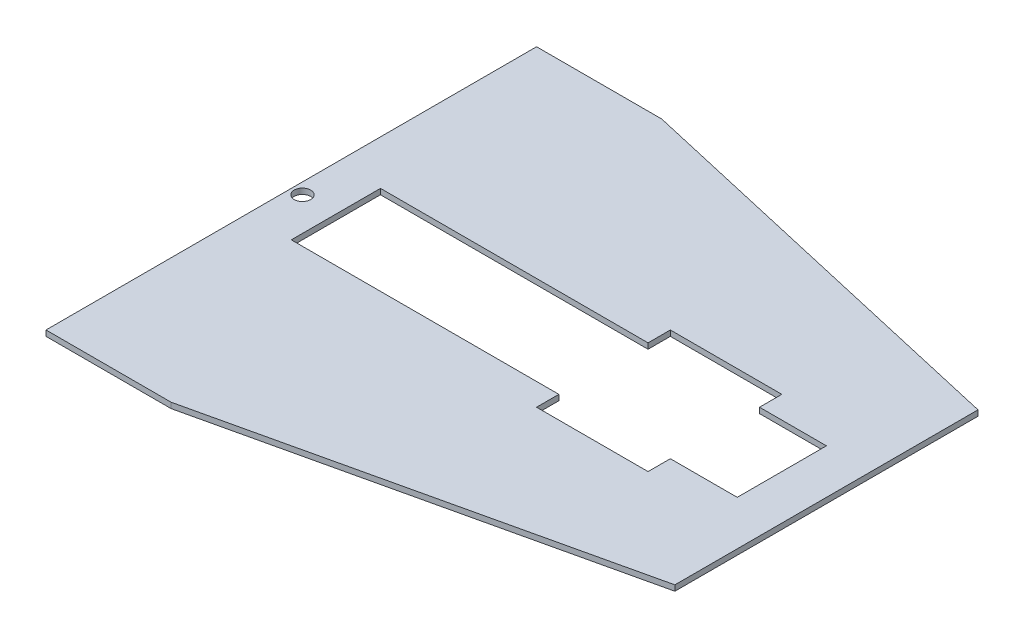
from build123d import *

# Parameters (mm, degrees)
SKETCH1_R           = 4.699
BOSS_EXTRUDE1_DEPTH = 3.175


with BuildPart() as part:
    # Sketch1 → Boss-Extrude1 (new body)
    with BuildSketch(Plane(origin=(0, 0, 0), x_dir=(1, 0, 0), z_dir=(0, 1, 0))):
        Polygon((0, 0), (71.282950754, 0), (304.8, -53.375325558), (304.8, -226.024674442), (71.282950754, -279.4), (0, -279.4), align=None)
        with Locations(Location((6.35, -139.7, 0), (0, 0, 270))):
            Circle(SKETCH1_R, mode=Mode.SUBTRACT)
        Polygon((25.4, -165.1), (177.8, -165.1), (177.8, -177.8), (241.3, -177.8), (241.3, -165.1), (279.4, -165.1), (279.4, -114.3), (241.3, -114.3), (241.3, -101.6), (177.8, -101.6), (177.8, -114.3), (25.4, -114.3), align=None, mode=Mode.SUBTRACT)
    extrude(amount=BOSS_EXTRUDE1_DEPTH)


solid = part.part
